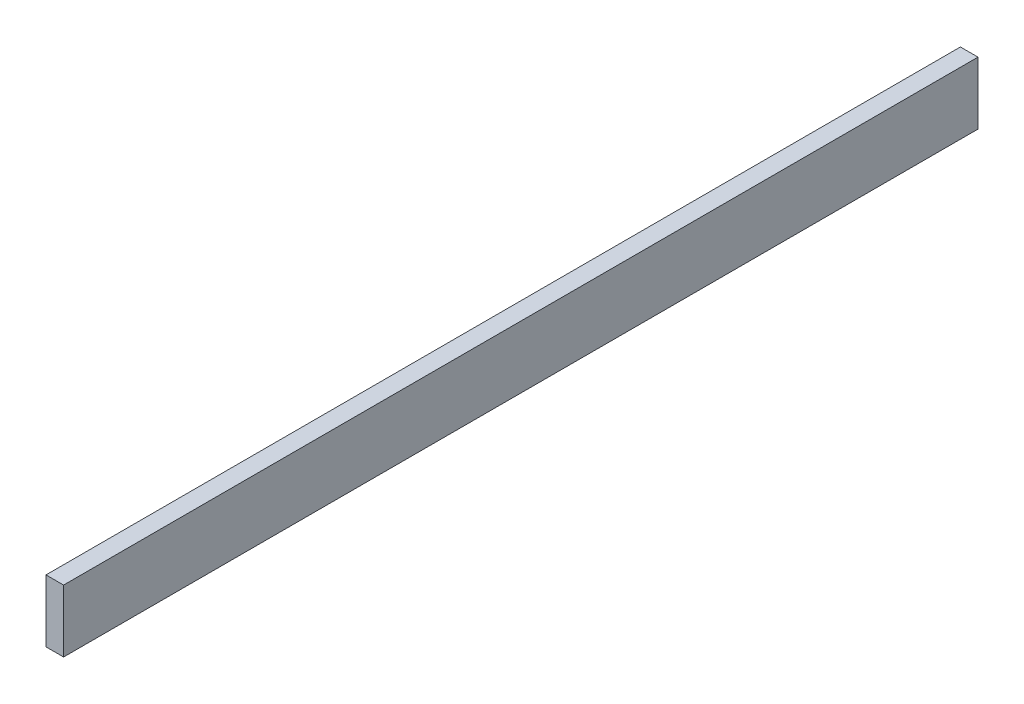
from build123d import *

# Parameters (mm, degrees)
SKETCH1_W                            = 12.7
SKETCH1_H                            = 45
CEK_ICECEK_RAY_IC_PROFIL_SAG_1_DEPTH = 660


with BuildPart() as part:
    # Sketch1 → CEK_icecek_ray_ic_profil_sag_1 (new body)
    with BuildSketch(Plane.XY):
        with Locations((611.65, 36.5)):
            Rectangle(SKETCH1_W, SKETCH1_H)
    extrude(amount=-CEK_ICECEK_RAY_IC_PROFIL_SAG_1_DEPTH)


solid = part.part
